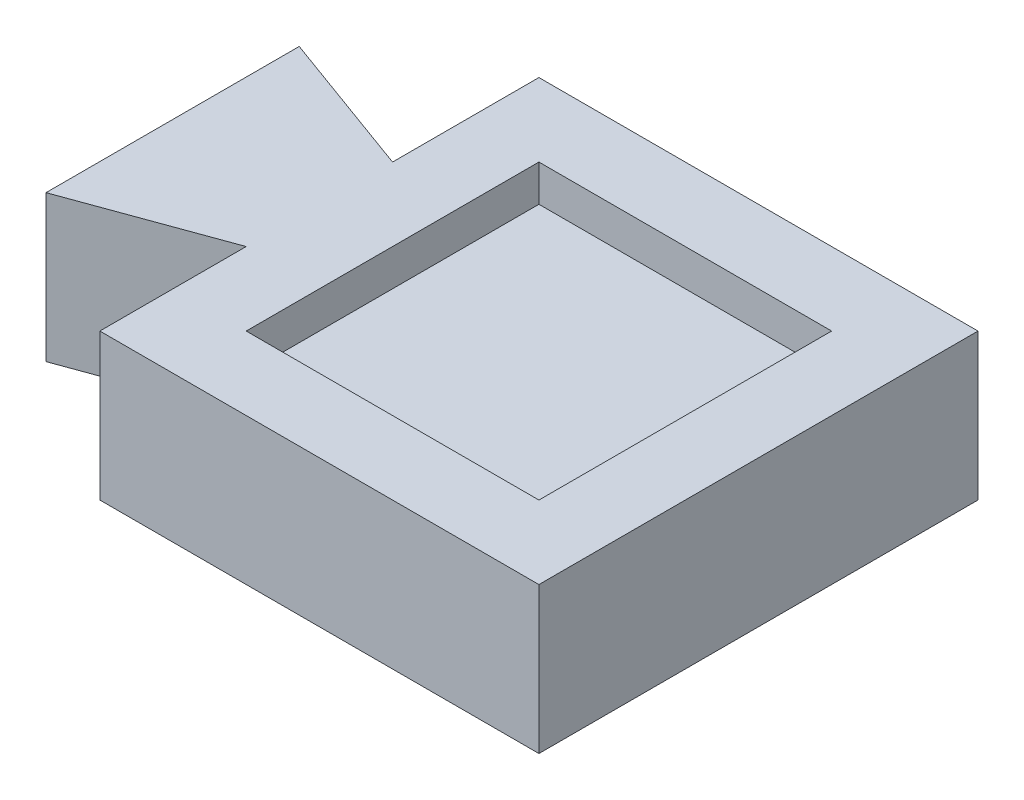
from build123d import *

# Parameters (mm, degrees)
BOSS_EXTRUDE1_DEPTH = 25.4
SKETCH2_W           = 50.8
SKETCH2_H           = 50.8
CUT_EXTRUDE1_DEPTH  = 6.35


with BuildPart() as part:
    # Sketch1 → Boss-Extrude1 (new body)
    with BuildSketch(Plane(origin=(0, 0, 0), x_dir=(1, 0, 0), z_dir=(0, 1, 0))):
        Polygon((0, -25.4), (-25.471863156, -16.129), (-25.471863156, -60.071), (0, -50.8), (0, -76.2), (76.2, -76.2), (76.2, 0), (0, 0), align=None)
    extrude(amount=BOSS_EXTRUDE1_DEPTH)

    # Sketch2 → Cut-Extrude1 (cut)
    with BuildSketch(Plane(origin=(0, 25.4, 0), x_dir=(1, 0, 0), z_dir=(0, 1, 0))):
        with Locations((38.1, -38.1)):
            Rectangle(SKETCH2_W, SKETCH2_H)
    extrude(amount=-CUT_EXTRUDE1_DEPTH, mode=Mode.SUBTRACT)


solid = part.part
